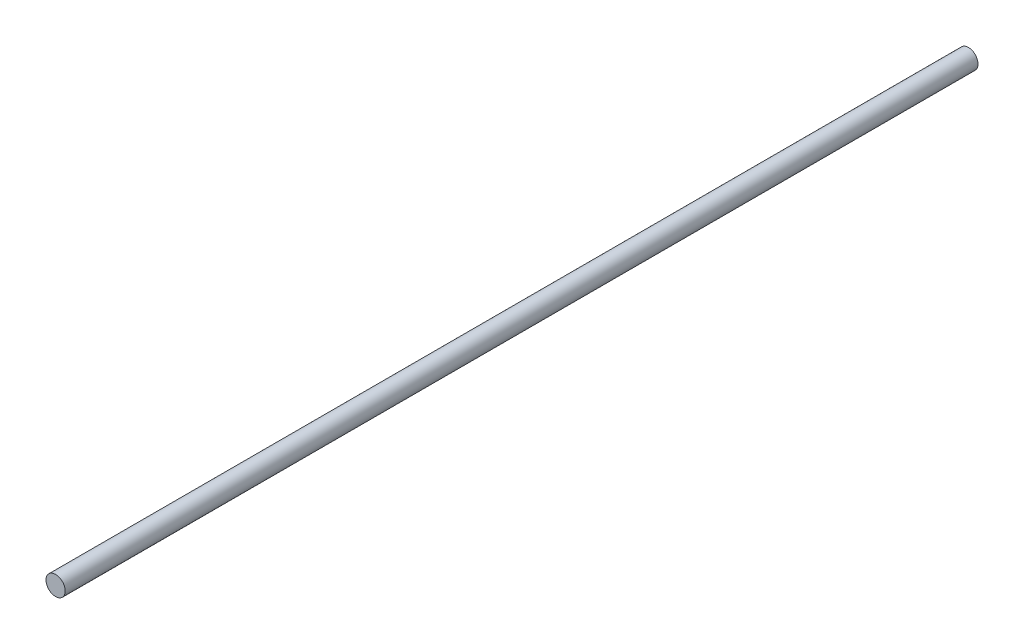
from build123d import *

# Parameters (mm, degrees)
CROQUIS1_R              = 10
SALIENTE_EXTRUIR2_DEPTH = 950


with BuildPart() as part:
    # Croquis1 → Saliente-Extruir2 (new body)
    with BuildSketch(Plane.XY):
        with Locations(Location((0, 0, 0), (0, 0, 180))):
            Circle(CROQUIS1_R)
    extrude(amount=SALIENTE_EXTRUIR2_DEPTH)


solid = part.part
